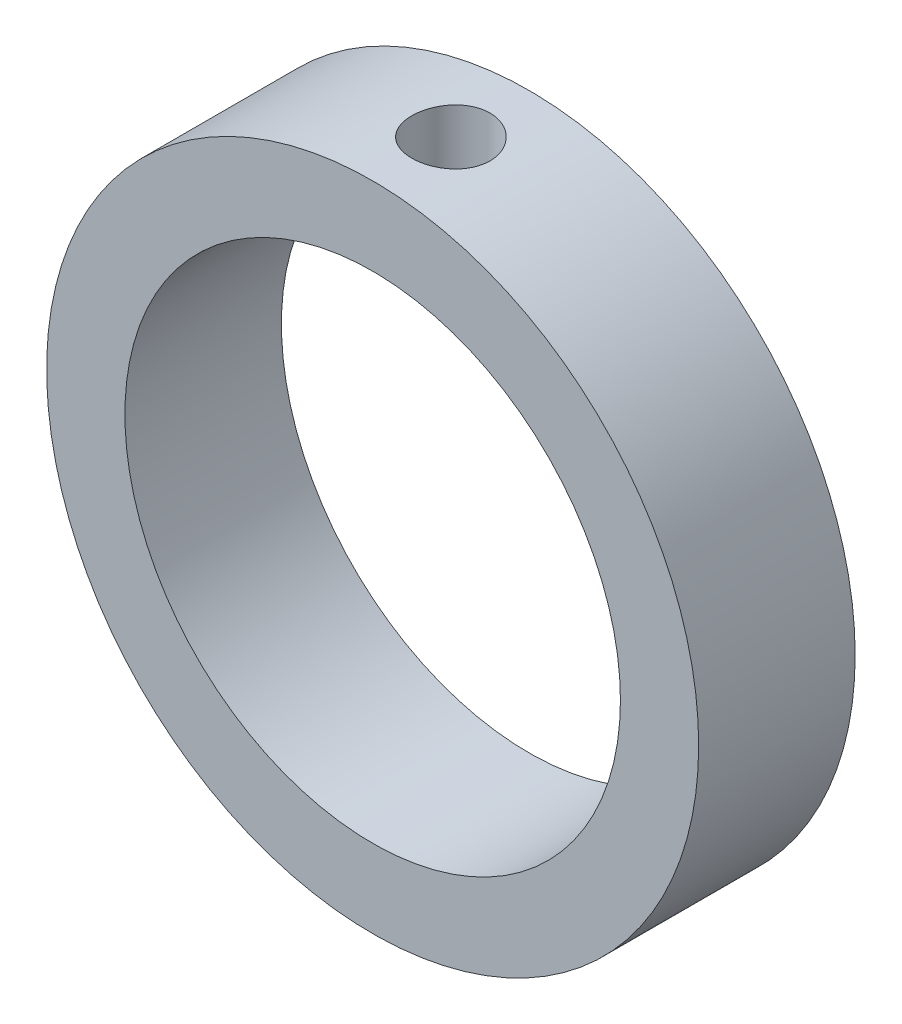
from build123d import *

# Parameters (mm, degrees)
SKETCH1_R               = 12.5
SKETCH1_R_2             = 9.5
BOSS_EXTRUDE1_DEPTH     = 3
CUT_EXTRUDE1_REACH      = 19.93
CUT_EXTRUDE1_END_RADIUS = 12.5
SKETCH2_R               = 1.5


with BuildPart() as part:
    # Sketch1 → Boss-Extrude1 (new, symmetric)
    with BuildSketch(Plane.XY):
        Circle(SKETCH1_R)
        Circle(SKETCH1_R_2, mode=Mode.SUBTRACT)
    extrude(amount=BOSS_EXTRUDE1_DEPTH, both=True)

    # Cut-Extrude1: up to this cylinder (the profile starts inside it)
    cut_extrude1_end = Plane(origin=(0, 0, 0), z_dir=(0, 0, -1)) * Cylinder(CUT_EXTRUDE1_END_RADIUS, 65.86, mode=Mode.PRIVATE)
    # Sketch2 → Cut-Extrude1 (cut, up to the surface)
    with BuildSketch(Plane(origin=(0, 0, 0), x_dir=(1, 0, 0), z_dir=(0, 1, 0)), mode=Mode.PRIVATE) as cut_extrude1_sk1:
        with Locations(Location((0, 0, 0), (0, 0, 90))):
            Circle(SKETCH2_R)
    cut_extrude1_tool1 = extrude(cut_extrude1_sk1.sketch, amount=CUT_EXTRUDE1_REACH, mode=Mode.PRIVATE) & cut_extrude1_end
    add(cut_extrude1_tool1.solids().sort_by_distance((0, 0, 0))[0], mode=Mode.SUBTRACT)


solid = part.part
